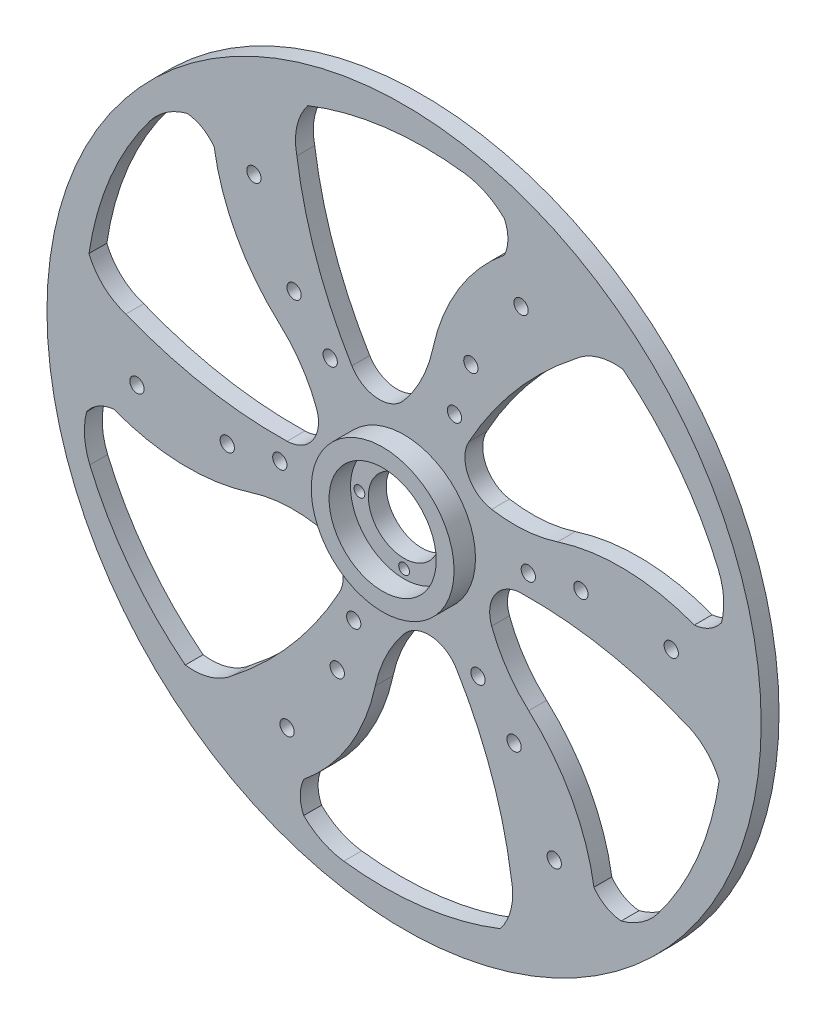
from build123d import *

# Parameters (mm, degrees)
SKETCH1_R           = 100
SKETCH1_R_2         = 2
SKETCH1_R_3         = 10
BOSS_EXTRUDE1_DEPTH = 5
SKETCH2_R           = 20
SKETCH2_R_2         = 15
BOSS_EXTRUDE2_DEPTH = 6
CUT_EXTRUDE1_REACH  = 143.549
SKETCH3_R           = 1.5


with BuildPart() as part:
    # Sketch1 → Boss-Extrude1 (new body)
    with BuildSketch(Plane.XY):
        Circle(SKETCH1_R)
        with Locations((-32.76709405, -67.463453421)):
            Circle(SKETCH1_R_2, mode=Mode.SUBTRACT)
        with BuildLine():
            ThreePointArc((-18.140194711, -27.362934842), (-31.235810605, -46.349018862), (-47.883759759, -62.311861059))
            ThreePointArc((-47.883759759, -62.311861059), (-54.116540013, -65.899401412), (-61.282970137, -66.499630328))
            ThreePointArc((-61.282970137, -66.499630328), (-76.856869776, -50.591887199), (-87.998157845, -31.318217554))
            ThreePointArc((-87.998157845, -31.318217554), (-89.471065891, -25.164589135), (-88.884816772, -18.864357964))
            ThreePointArc((-88.884816772, -18.864357964), (-85.565152522, -15.829659751), (-81.277194651, -14.472095285))
            ThreePointArc((-81.277194651, -14.472095285), (-62.213907679, -18.258685792), (-42.975567969, -15.495813542))
            ThreePointArc((-42.975567969, -15.495813542), (-33.830845233, -13.716750405), (-24.525208658, -14.159635821))
            ThreePointArc((-24.525208658, -14.159635821), (-17.925326288, -19.113504773), (-18.140194711, -27.362934842))
        make_face(mode=Mode.SUBTRACT)
        with Locations((-74.808611515, -5.354590855)):
            Circle(SKETCH1_R_2, mode=Mode.SUBTRACT)
        with Locations((-18.706228616, -46.368922901)):
            Circle(SKETCH1_R_2, mode=Mode.SUBTRACT)
        with Locations((-14.100447384, -32.034003552)):
            Circle(SKETCH1_R_2, mode=Mode.SUBTRACT)
        with Locations((-49.509779486, -6.98439226)):
            Circle(SKETCH1_R_2, mode=Mode.SUBTRACT)
        with Locations((-34.792484553, -3.805656136)):
            Circle(SKETCH1_R_2, mode=Mode.SUBTRACT)
        with BuildLine():
            ThreePointArc((14.62689934, -29.39133687), (24.521522472, -50.225514922), (30.021774754, -72.62448291))
            ThreePointArc((30.021774754, -72.62448291), (30.012285711, -79.815999122), (26.948884138, -86.322424122))
            ThreePointArc((26.948884138, -86.322424122), (5.385424652, -91.85594528), (-16.876706919, -91.867748957))
            ThreePointArc((-16.876706919, -91.867748957), (-22.942359479, -90.066510532), (-28.105395163, -86.408688317))
            ThreePointArc((-28.105395163, -86.408688317), (-29.073688784, -82.016425638), (-28.105395163, -77.624162959))
            ThreePointArc((-28.105395163, -77.624162959), (-15.294468104, -63.008167415), (-8.068015805, -44.965840374))
            ThreePointArc((-8.068015805, -44.965840374), (-5.036368308, -36.156746606), (0, -28.319271641))
            ThreePointArc((0, -28.319271641), (7.590117545, -25.080540323), (14.62689934, -29.39133687))
        make_face(mode=Mode.SUBTRACT)
        with Locations((42.041517465, -62.108862566)):
            Circle(SKETCH1_R_2, mode=Mode.SUBTRACT)
        with Locations((20.692037169, -28.228347416)):
            Circle(SKETCH1_R_2, mode=Mode.SUBTRACT)
        with Locations((30.80355087, -39.384530641)):
            Circle(SKETCH1_R_2, mode=Mode.SUBTRACT)
        with BuildLine():
            ThreePointArc((32.76709405, -2.028402028), (55.757333077, -3.876496061), (77.905534514, -10.312621851))
            ThreePointArc((77.905534514, -10.312621851), (84.128825724, -13.91659771), (88.231854275, -19.822793794))
            ThreePointArc((88.231854275, -19.822793794), (82.242294427, -41.264058082), (71.121450925, -60.549531403))
            ThreePointArc((71.121450925, -60.549531403), (66.528706412, -64.901921398), (60.779421608, -67.544330353))
            ThreePointArc((60.779421608, -67.544330353), (56.491463738, -66.186765887), (53.171799488, -63.152067674))
            ThreePointArc((53.171799488, -63.152067674), (46.919439575, -44.749481623), (34.907552164, -29.470026832))
            ThreePointArc((34.907552164, -29.470026832), (28.794476925, -22.439996201), (24.525208658, -14.159635821))
            ThreePointArc((24.525208658, -14.159635821), (25.515443833, -5.96703555), (32.76709405, -2.028402028))
        make_face(mode=Mode.SUBTRACT)
        with BuildLine():
            ThreePointArc((-32.76709405, 2.028402028), (-55.757333077, 3.876496061), (-77.905534514, 10.312621851))
            ThreePointArc((-77.905534514, 10.312621851), (-84.128825724, 13.91659771), (-88.231854275, 19.822793794))
            ThreePointArc((-88.231854275, 19.822793794), (-82.242294427, 41.264058082), (-71.121450925, 60.549531403))
            ThreePointArc((-71.121450925, 60.549531403), (-66.528706412, 64.901921398), (-60.779421608, 67.544330353))
            ThreePointArc((-60.779421608, 67.544330353), (-56.491463738, 66.186765887), (-53.171799488, 63.152067674))
            ThreePointArc((-53.171799488, 63.152067674), (-46.919439575, 44.749481623), (-34.907552164, 29.470026832))
            ThreePointArc((-34.907552164, 29.470026832), (-28.794476925, 22.439996201), (-24.525208658, 14.159635821))
            ThreePointArc((-24.525208658, 14.159635821), (-25.515443833, 5.96703555), (-32.76709405, 2.028402028))
        make_face(mode=Mode.SUBTRACT)
        with Locations((-30.80355087, 39.384530641)):
            Circle(SKETCH1_R_2, mode=Mode.SUBTRACT)
        with Locations((-20.692037169, 28.228347416)):
            Circle(SKETCH1_R_2, mode=Mode.SUBTRACT)
        with Locations((-42.041517465, 62.108862566)):
            Circle(SKETCH1_R_2, mode=Mode.SUBTRACT)
        with BuildLine():
            ThreePointArc((-14.62689934, 29.39133687), (-24.521522472, 50.225514922), (-30.021774754, 72.62448291))
            ThreePointArc((-30.021774754, 72.62448291), (-30.012285711, 79.815999122), (-26.948884138, 86.322424122))
            ThreePointArc((-26.948884138, 86.322424122), (-5.385424652, 91.85594528), (16.876706919, 91.867748957))
            ThreePointArc((16.876706919, 91.867748957), (22.942359479, 90.066510532), (28.105395163, 86.408688317))
            ThreePointArc((28.105395163, 86.408688317), (29.073688784, 82.016425638), (28.105395163, 77.624162959))
            ThreePointArc((28.105395163, 77.624162959), (15.294468104, 63.008167415), (8.068015805, 44.965840374))
            ThreePointArc((8.068015805, 44.965840374), (5.036368308, 36.156746606), (0, 28.319271641))
            ThreePointArc((0, 28.319271641), (-7.590117545, 25.080540323), (-14.62689934, 29.39133687))
        make_face(mode=Mode.SUBTRACT)
        with Locations((34.792484553, 3.805656136)):
            Circle(SKETCH1_R_2, mode=Mode.SUBTRACT)
        with Locations((49.509779486, 6.98439226)):
            Circle(SKETCH1_R_2, mode=Mode.SUBTRACT)
        with Locations((14.100447384, 32.034003552)):
            Circle(SKETCH1_R_2, mode=Mode.SUBTRACT)
        with Locations((18.706228616, 46.368922901)):
            Circle(SKETCH1_R_2, mode=Mode.SUBTRACT)
        with Locations((74.808611515, 5.354590855)):
            Circle(SKETCH1_R_2, mode=Mode.SUBTRACT)
        with BuildLine():
            ThreePointArc((18.140194711, 27.362934842), (31.235810605, 46.349018862), (47.883759759, 62.311861059))
            ThreePointArc((47.883759759, 62.311861059), (54.116540013, 65.899401412), (61.282970137, 66.499630328))
            ThreePointArc((61.282970137, 66.499630328), (76.856869776, 50.591887199), (87.998157845, 31.318217554))
            ThreePointArc((87.998157845, 31.318217554), (89.471065891, 25.164589135), (88.884816772, 18.864357964))
            ThreePointArc((88.884816772, 18.864357964), (85.565152522, 15.829659751), (81.277194651, 14.472095285))
            ThreePointArc((81.277194651, 14.472095285), (62.213907679, 18.258685792), (42.975567969, 15.495813542))
            ThreePointArc((42.975567969, 15.495813542), (33.830845233, 13.716750405), (24.525208658, 14.159635821))
            ThreePointArc((24.525208658, 14.159635821), (17.925326288, 19.113504773), (18.140194711, 27.362934842))
        make_face(mode=Mode.SUBTRACT)
        with Locations((32.76709405, 67.463453421)):
            Circle(SKETCH1_R_2, mode=Mode.SUBTRACT)
        Circle(SKETCH1_R_3, mode=Mode.SUBTRACT)
    extrude(amount=BOSS_EXTRUDE1_DEPTH)

    # Sketch2 → Boss-Extrude2 (add)
    with BuildSketch(Plane.XY.offset(5)):
        Circle(SKETCH2_R)
        Circle(SKETCH2_R_2, mode=Mode.SUBTRACT)
    extrude(amount=BOSS_EXTRUDE2_DEPTH)

    # Sketch3 → Cut-Extrude1 (cut, up to next)
    with BuildSketch(Plane.XY.offset(5), mode=Mode.PRIVATE) as cut_extrude1_sk1:
        with Locations((0, 12.5)):
            Circle(SKETCH3_R)
    cut_extrude1_tool1 = extrude(cut_extrude1_sk1.sketch, amount=-CUT_EXTRUDE1_REACH, mode=Mode.PRIVATE) & part.part
    # Sketch3 → Cut-Extrude1 (cut, up to next)
    with BuildSketch(Plane.XY.offset(5), mode=Mode.PRIVATE) as cut_extrude1_sk2:
        with Locations((12.5, 0)):
            Circle(SKETCH3_R)
    cut_extrude1_tool2 = extrude(cut_extrude1_sk2.sketch, amount=-CUT_EXTRUDE1_REACH, mode=Mode.PRIVATE) & part.part
    # Sketch3 → Cut-Extrude1 (cut, up to next)
    with BuildSketch(Plane.XY.offset(5), mode=Mode.PRIVATE) as cut_extrude1_sk3:
        with Locations((0, -12.5)):
            Circle(SKETCH3_R)
    cut_extrude1_tool3 = extrude(cut_extrude1_sk3.sketch, amount=-CUT_EXTRUDE1_REACH, mode=Mode.PRIVATE) & part.part
    # Sketch3 → Cut-Extrude1 (cut, up to next)
    with BuildSketch(Plane.XY.offset(5), mode=Mode.PRIVATE) as cut_extrude1_sk4:
        with Locations((-12.5, 0)):
            Circle(SKETCH3_R)
    cut_extrude1_tool4 = extrude(cut_extrude1_sk4.sketch, amount=-CUT_EXTRUDE1_REACH, mode=Mode.PRIVATE) & part.part
    add(cut_extrude1_tool1.solids().sort_by_distance((0, 12.5, 5))[0], mode=Mode.SUBTRACT)
    add(cut_extrude1_tool2.solids().sort_by_distance((12.5, 0, 5))[0], mode=Mode.SUBTRACT)
    add(cut_extrude1_tool3.solids().sort_by_distance((0, -12.5, 5))[0], mode=Mode.SUBTRACT)
    add(cut_extrude1_tool4.solids().sort_by_distance((-12.5, 0, 5))[0], mode=Mode.SUBTRACT)


solid = part.part
